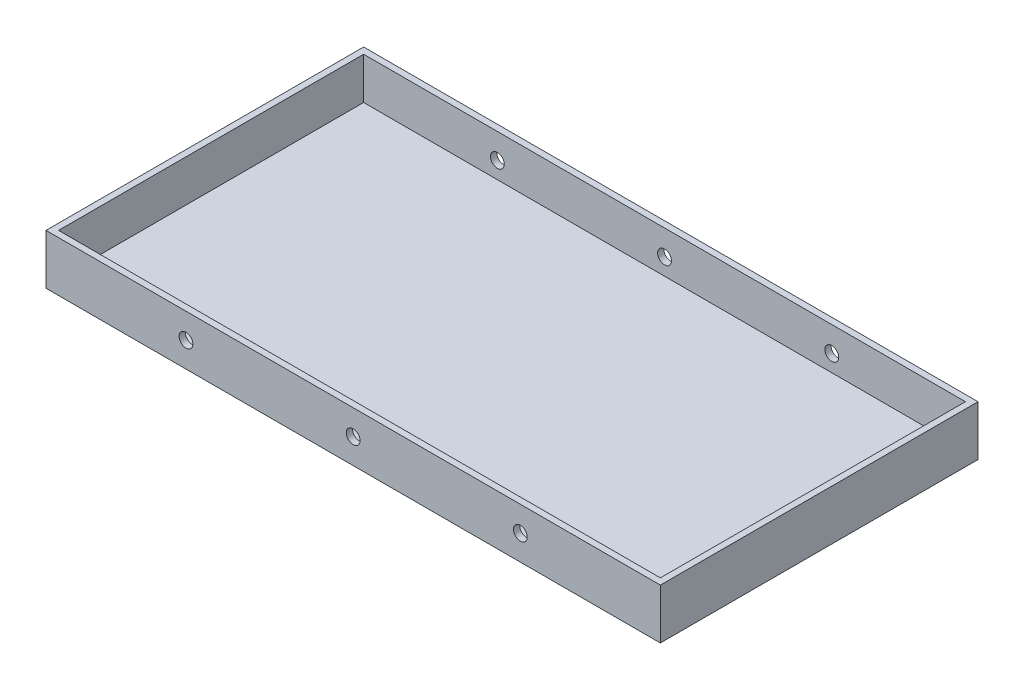
from build123d import *

# Parameters (mm, degrees)
SKETCH_1_W          = 147
SKETCH_1_H          = 76
EXTRUDE_1_DEPTH     = 12
SKETCH_2_W          = 144
SKETCH_2_H          = 73
CUT_EXTRUDE_1_DEPTH = 10
SKETCH_3_R          = 1.65
CUT_EXTRUDE_2_DEPTH = 166.918654768


with BuildPart() as part:
    # 草图1 → 凸台-拉伸1 (new body)
    with BuildSketch(Plane(origin=(0, 0, 0), x_dir=(1, 0, 0), z_dir=(0, 1, 0))):
        with Locations((73.5, 38)):
            Rectangle(SKETCH_1_W, SKETCH_1_H)
    extrude(amount=EXTRUDE_1_DEPTH)

    # 草图2 → 切除-拉伸1 (cut)
    with BuildSketch(Plane(origin=(0, 12, 0), x_dir=(1, 0, 0), z_dir=(0, 1, 0))):
        with Locations((73.5, 38)):
            Rectangle(SKETCH_2_W, SKETCH_2_H)
    extrude(amount=-CUT_EXTRUDE_1_DEPTH, mode=Mode.SUBTRACT)

    # 草图3 → 切除-拉伸2 (cut, through all)
    with BuildSketch(Plane(origin=(0, 0, -76), x_dir=(-1, 0, 0), z_dir=(0, 0, -1))):
        with Locations((-113.5, 6)):
            Circle(SKETCH_3_R)
        with Locations((-33.5, 6)):
            Circle(SKETCH_3_R)
        with Locations((-73.5, 6)):
            Circle(SKETCH_3_R)
    extrude(amount=-CUT_EXTRUDE_2_DEPTH, mode=Mode.SUBTRACT)


solid = part.part
